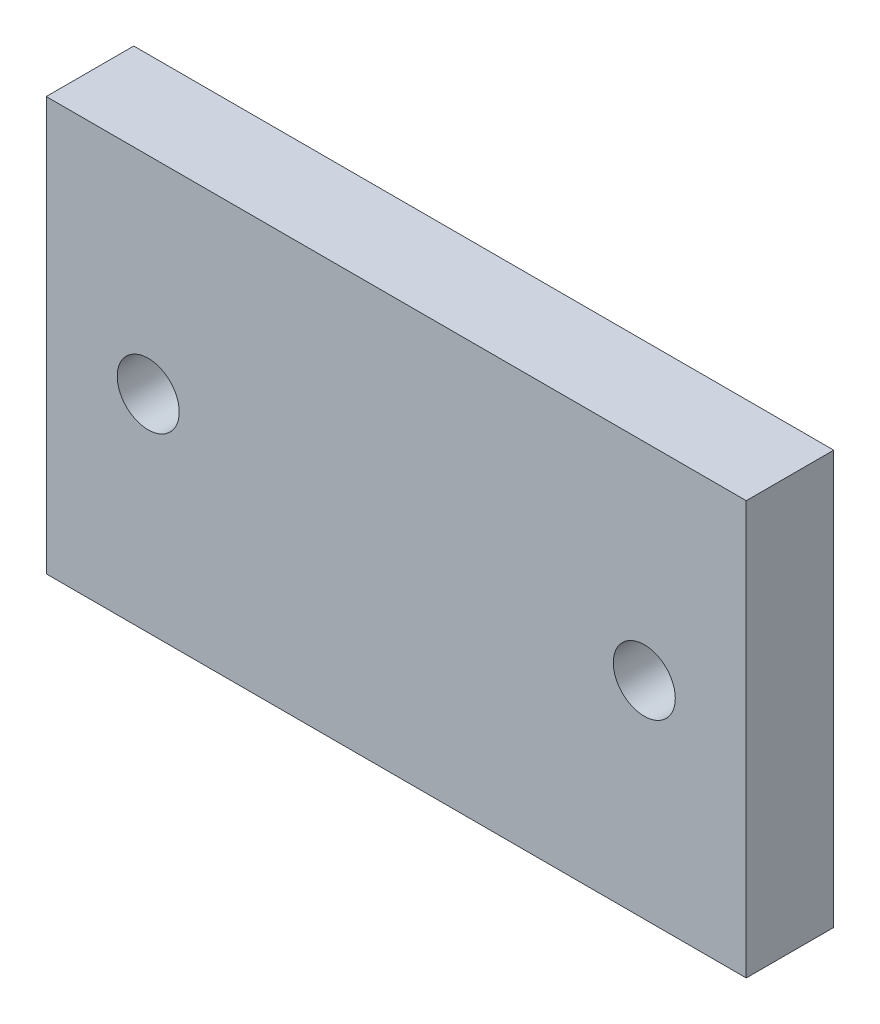
from build123d import *

# Parameters (mm, degrees)
SKETCH1_W                 = 50.8
SKETCH1_H                 = 30
SKETCH1_R                 = 2.25
BOSS_EXTRUDE1_DEPTH       = 6.35
M4X0_7_TAPPED_HOLE1_D     = 3.3
M4X0_7_TAPPED_HOLE1_DEPTH = 14.732
M4X0_7_TAPPED_HOLE1_TIP   = 0.991420021


with BuildPart() as part:
    # Sketch1 → Boss-Extrude1 (new body)
    with BuildSketch(Plane.XY):
        with Locations((25.4, 15)):
            Rectangle(SKETCH1_W, SKETCH1_H)
        with Locations((7.400000059, 15)):
            Circle(SKETCH1_R, mode=Mode.SUBTRACT)
        with Locations((43.400000059, 15)):
            Circle(SKETCH1_R, mode=Mode.SUBTRACT)
    extrude(amount=BOSS_EXTRUDE1_DEPTH)

    # M4x0.7 Tapped Hole1
    with Locations(Plane(origin=(0, 0, 0), x_dir=(-1, 0, 0), z_dir=(0, -1, 0))):
        with Locations((-12.7, -3.175), (-38.1, -3.175)):
            Hole(M4X0_7_TAPPED_HOLE1_D / 2, depth=M4X0_7_TAPPED_HOLE1_DEPTH)
            with Locations((0, 0, -(M4X0_7_TAPPED_HOLE1_DEPTH + M4X0_7_TAPPED_HOLE1_TIP / 2))):  # 118° drill point
                Cone(0, M4X0_7_TAPPED_HOLE1_D / 2, M4X0_7_TAPPED_HOLE1_TIP, mode=Mode.SUBTRACT)


solid = part.part
